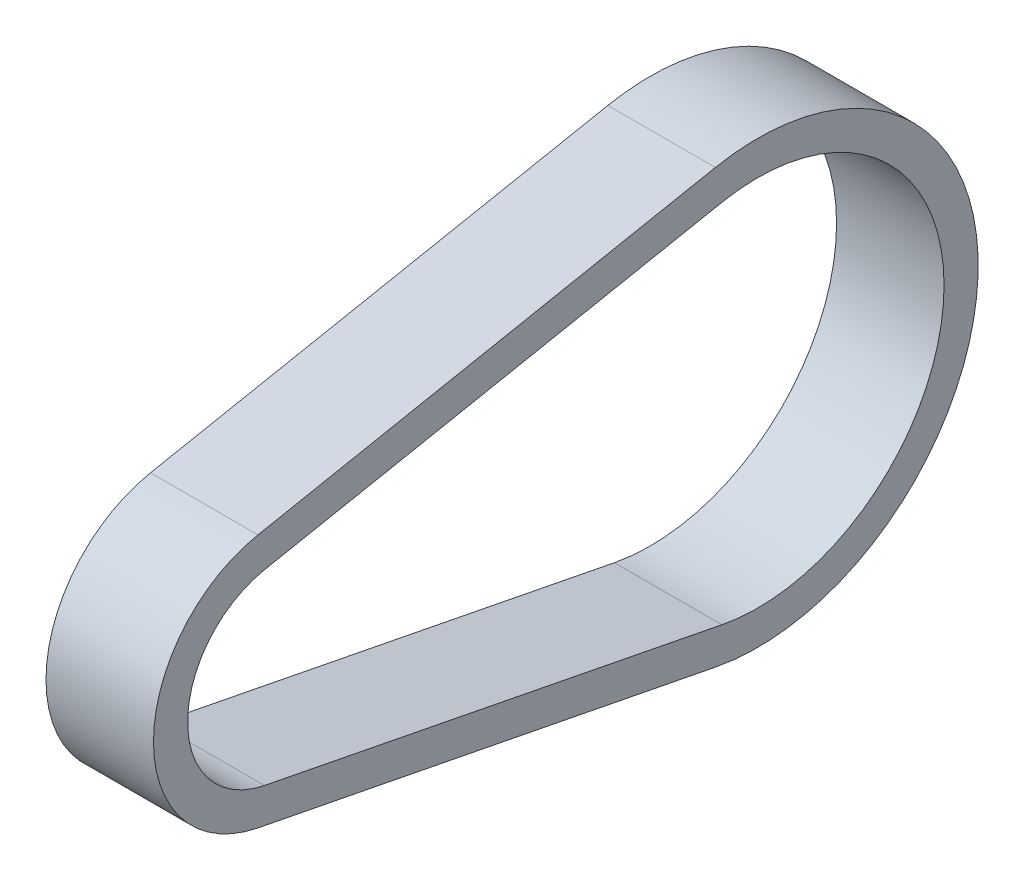
from build123d import *

# Parameters (mm, degrees)
BOSS_EXTRUDE1_DEPTH = 7.5


with BuildPart() as part:
    # Sketch1 → Boss-Extrude1 (new, symmetric)
    with BuildSketch(Plane(origin=(0, 0, 0), x_dir=(0, 0, -1), z_dir=(1, 0, 0))):
        with BuildLine():
            Line((-3.465198797, 17.710894336), (60.365040532, 30.199505262))
            ThreePointArc((60.365040532, 30.199505262), (97.04578, 0), (60.365040532, -30.199505262))
            Line((60.365040532, -30.199505262), (-3.465198797, -17.710894336))
            ThreePointArc((-3.465198797, -17.710894336), (-18.0467, 0), (-3.465198797, 17.710894336))
        make_face()
        with BuildLine():
            Line((-2.550737467, 13.037013002), (61.279501861, 25.525623927))
            ThreePointArc((61.279501861, 25.525623927), (92.28328, 0), (61.279501861, -25.525623927))
            Line((61.279501861, -25.525623927), (-2.550737467, -13.037013002))
            ThreePointArc((-2.550737467, -13.037013002), (-13.2842, 0), (-2.550737467, 13.037013002))
        make_face(mode=Mode.SUBTRACT)
    extrude(amount=BOSS_EXTRUDE1_DEPTH, both=True)


solid = part.part
